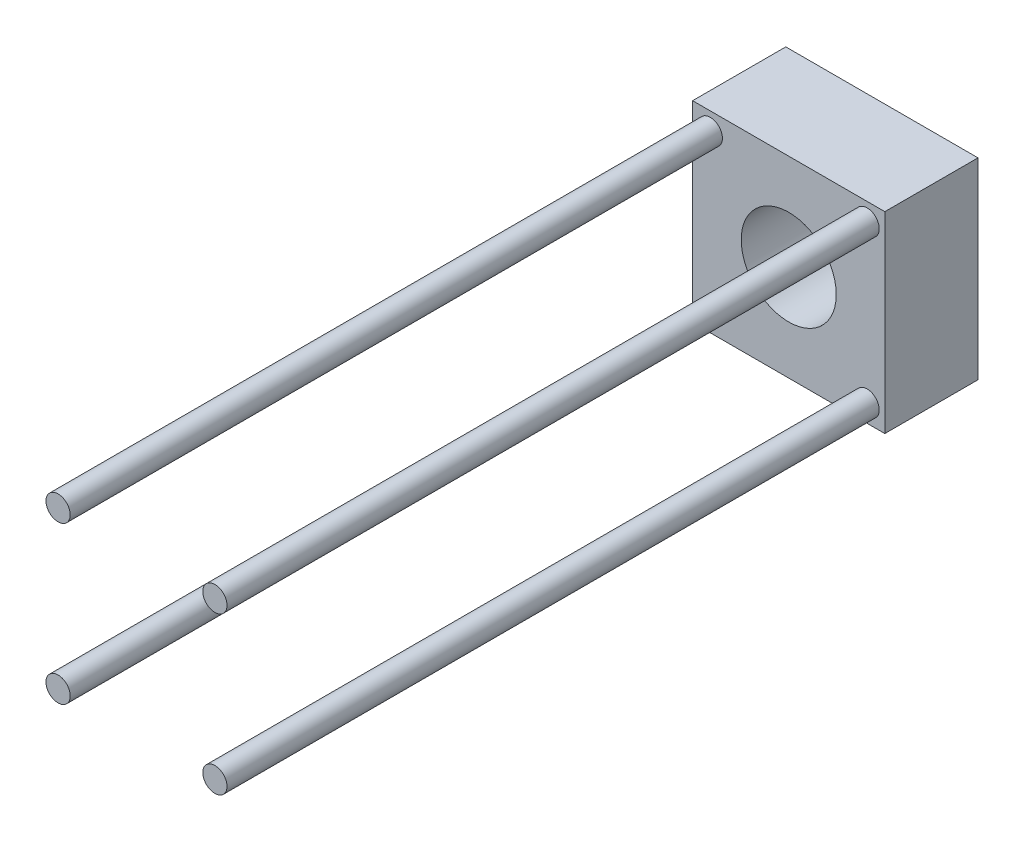
from build123d import *

# Parameters (mm, degrees)
MAINBODY_EXTRUDE_START = -20
PROJECTIONXY_SKETCH_W  = 10.314570696
PROJECTIONXY_SKETCH_H  = 10.314570696
MAINBODY_EXTRUDE_DEPTH = 5
BORE_CUT_DEPTH         = 22.28838144
BORE_CUT_DEPTH_BACK    = 22.28838144
BORE_SKETCH_R          = 2.55
POSTS_EXTRUDE_START    = -20
POSTS_SKETCH_R         = 0.65
POSTS_EXTRUDE_DEPTH    = 40


with BuildPart() as part:
    # projectionXy_sketch → mainBody_extrude (new body)
    with BuildSketch(Plane.XY.offset(MAINBODY_EXTRUDE_START)):
        Rectangle(PROJECTIONXY_SKETCH_W, PROJECTIONXY_SKETCH_H)
    extrude(amount=MAINBODY_EXTRUDE_DEPTH)

    # bore_sketch → bore_cut (cut, two sides: drawn at the far end of the back side and taken through both)
    with BuildSketch(Plane.XY.offset(-BORE_CUT_DEPTH_BACK)):
        Circle(BORE_SKETCH_R)
    extrude(amount=BORE_CUT_DEPTH + BORE_CUT_DEPTH_BACK, mode=Mode.SUBTRACT)

    # posts_sketch → posts_extrude (add)
    with BuildSketch(Plane.XY.offset(POSTS_EXTRUDE_START)):
        with Locations((4.207285348, -4.207285348)):
            Circle(POSTS_SKETCH_R)
        with Locations((-4.207285348, -4.207285348)):
            Circle(POSTS_SKETCH_R)
        with Locations((-4.207285348, 4.207285348)):
            Circle(POSTS_SKETCH_R)
        with Locations((4.207285348, 4.207285348)):
            Circle(POSTS_SKETCH_R)
    extrude(amount=POSTS_EXTRUDE_DEPTH)


solid = part.part
